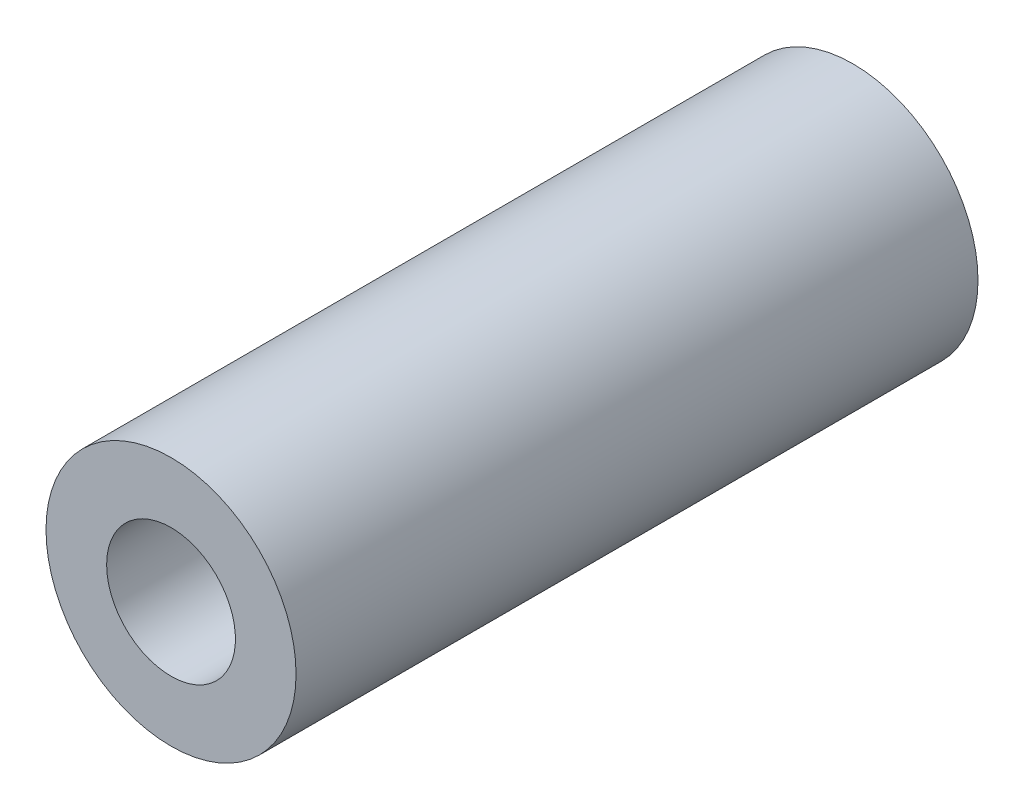
from build123d import *

# Parameters (mm, degrees)
ESBO_O1_R                = 8.25
ESBO_O1_R_2              = 4.25
RESSALTO_EXTRUS_O1_DEPTH = 22.5


with BuildPart() as part:
    # Esboço1 → Ressalto-extrusão1 (new, symmetric)
    with BuildSketch(Plane.XY):
        with Locations(Location((0, 0, 0), (0, 0, 180))):
            Circle(ESBO_O1_R)
        with Locations(Location((0, 0, 0), (0, 0, 180))):
            Circle(ESBO_O1_R_2, mode=Mode.SUBTRACT)
    extrude(amount=RESSALTO_EXTRUS_O1_DEPTH, both=True)


solid = part.part
